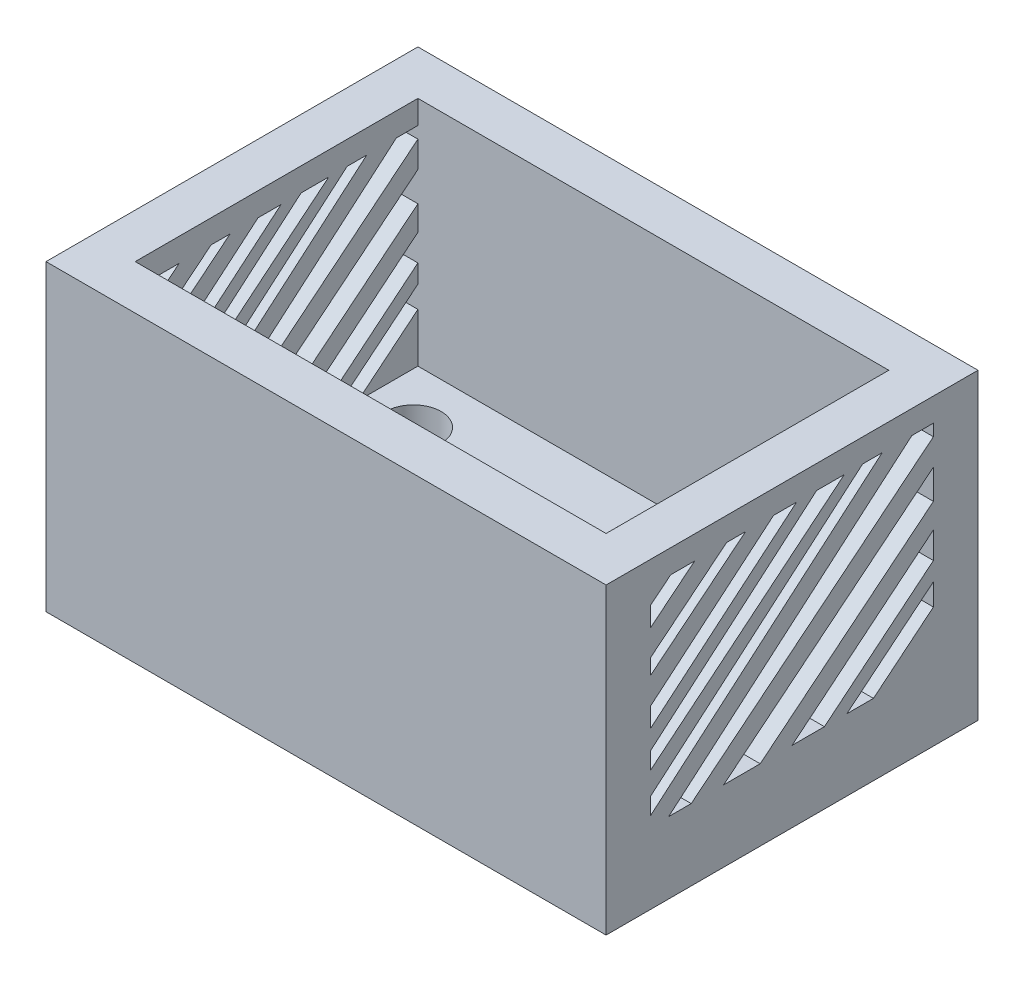
from build123d import *

# Parameters (mm, degrees)
SKETCH1_W                 = 31.4
SKETCH1_H                 = 20.85
SKETCH1_W_2               = 26.4
SKETCH1_H_2               = 15.85
BOSS_EXTRUDE1_DEPTH       = 4
BOSS_EXTRUDE2_START       = 4
SKETCH1_3_W               = 31.4
SKETCH1_3_H               = 20.85
SKETCH1_3_W_2             = 26.4
SKETCH1_3_H_2             = 15.85
BOSS_EXTRUDE2_DEPTH       = 13
SKETCH2_W                 = 26.4
SKETCH2_H                 = 3.2
CUT_EXTRUDE1_DEPTH        = 2.7
CUT_EXTRUDE3_DEPTH        = 47.7
F_1_0MM_DOWEL_HOLE1_D     = 3.1
F_1_0MM_DOWEL_HOLE1_DEPTH = 54.068666041
F_1_0MM_DOWEL_HOLE1_TIP   = 0.931333959


with BuildPart() as part:
    # Sketch1 → Boss-Extrude1 (new body)
    # profile 1 of 2: a face of its own
    with BuildSketch(Plane(origin=(0, 0, 0), x_dir=(1, 0, 0), z_dir=(0, 1, 0))):
        Rectangle(SKETCH1_W, SKETCH1_H)
        Rectangle(SKETCH1_W_2, SKETCH1_H_2, mode=Mode.SUBTRACT)
    # profile 2 of 2: a face of its own
    with BuildSketch(Plane(origin=(0, 0, 0), x_dir=(1, 0, 0), z_dir=(0, 1, 0))):
        Rectangle(SKETCH1_W_2, SKETCH1_H_2)
    extrude(amount=BOSS_EXTRUDE1_DEPTH)

    # Sketch1<3> → Boss-Extrude2 (add)
    with BuildSketch(Plane(origin=(0, 0, 0), x_dir=(1, 0, 0), z_dir=(0, 1, 0)).offset(BOSS_EXTRUDE2_START)):
        Rectangle(SKETCH1_3_W, SKETCH1_3_H)
        Rectangle(SKETCH1_3_W_2, SKETCH1_3_H_2, mode=Mode.SUBTRACT)
    extrude(amount=BOSS_EXTRUDE2_DEPTH)

    # Sketch2 → Cut-Extrude1 (cut)
    with BuildSketch(Plane(origin=(0, 4, 0), x_dir=(1, 0, 0), z_dir=(0, 1, 0))):
        with Locations((0, -6.325)):
            Rectangle(SKETCH2_W, SKETCH2_H)
    extrude(amount=-CUT_EXTRUDE1_DEPTH, mode=Mode.SUBTRACT)

    # Sketch3 → Cut-Extrude3 (cut)
    with BuildSketch(Plane(origin=(15.7, 0, 0), x_dir=(0, 0, -1), z_dir=(1, 0, 0))):
        Polygon((-6.804269328, 15.68296106), (-5.459911982, 15.68296106), (-7.925, 13.683572471), (-7.925, 14.773956554), align=None)
        Polygon((-3.671214098, 15.68296106), (-2.606582105, 15.68296106), (-7.925, 11.369287886), (-7.925, 12.232791762), align=None)
        Polygon((-1.037778428, 15.68296106), (0.25170719, 15.68296106), (-7.925, 8.797268756), (-7.925, 9.883158343), align=None)
        Polygon((1.375357987, 15.68296106), (2.927105978, 15.68296106), (-7.925, 6.767025954), (-7.925, 7.714901357), align=None)
        Polygon((3.956505154, 15.68296106), (5.054465963, 15.68296106), (-7.925, 4.562834301), (-7.925, 5.503509627), align=None)
        Polygon((6.716922224, 15.68296106), (7.925, 15.68296106), (7.925, 15.021555077), (-5.65165104, 4), (-6.919486669, 4), align=None)
        Polygon((7.925, 11.883512977), (-1.786125509, 4), (-3.836107122, 4), (7.925, 13.547692544), align=None)
        Polygon((1.815680904, 4), (0, 4), (7.925, 10.5), (7.925, 9.010797996), align=None)
        Polygon((4.565545231, 4), (3.069437246, 4), (7.925, 7.982480493), (7.925, 6.755388769), align=None)
    extrude(amount=-CUT_EXTRUDE3_DEPTH, mode=Mode.SUBTRACT)

    # Ø1.0mm Dowel Hole1
    with Locations(Plane(origin=(0, 4, 0), x_dir=(1, 0, 0), z_dir=(0, 1, 0))):
        with Locations((-10.35, 4.825), (10.35, 4.825)):
            Hole(F_1_0MM_DOWEL_HOLE1_D / 2, depth=F_1_0MM_DOWEL_HOLE1_DEPTH)
            with Locations((0, 0, -(F_1_0MM_DOWEL_HOLE1_DEPTH + F_1_0MM_DOWEL_HOLE1_TIP / 2))):  # 118° drill point
                Cone(0, F_1_0MM_DOWEL_HOLE1_D / 2, F_1_0MM_DOWEL_HOLE1_TIP, mode=Mode.SUBTRACT)


solid = part.part
